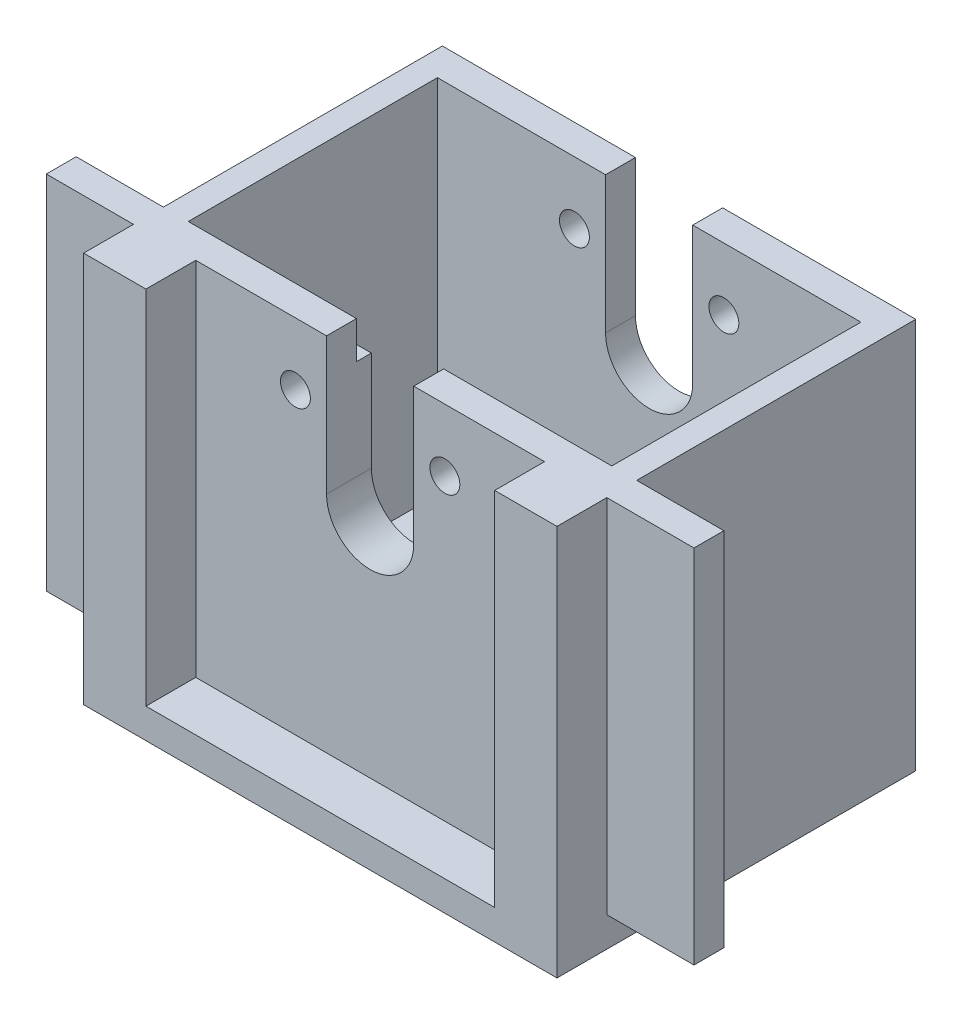
from build123d import *

# Parameters (mm, degrees)
SKETCH_1_W          = 190
SKETCH_1_H          = 144
SKETCH_1_R          = 6
EXTRUDE_1_DEPTH     = 12
SKETCH_2_W          = 190
SKETCH_2_H          = 12
SKETCH_2_W_2        = 260
EXTRUDE_2_DEPTH     = 145
SKETCH_3_R          = 6
CUT_EXTRUDE_1_DEPTH = 239.589605809
SKETCH_4_R          = 6
EXTRUDE_3_DEPTH     = 6
SKETCH_5_W          = 10
SKETCH_5_H          = 100
EXTRUDE_4_DEPTH     = 145
SKETCH_6_W          = 25
SKETCH_6_H          = 20
EXTRUDE_5_DEPTH     = 145


with BuildPart() as part:
    # 草图1 → 凸台-拉伸1 (new body)
    with BuildSketch(Plane(origin=(0, 0, 0), x_dir=(1, 0, 0), z_dir=(0, 1, 0))):
        Rectangle(SKETCH_1_W, SKETCH_1_H)
        with Locations(Location((-57, 41, 0), (0, 0, 270))):
            Circle(SKETCH_1_R, mode=Mode.SUBTRACT)
        with Locations(Location((57, 41, 0), (0, 0, 270))):
            Circle(SKETCH_1_R, mode=Mode.SUBTRACT)
        with Locations(Location((-57, -2, 0), (0, 0, 270))):
            Circle(SKETCH_1_R, mode=Mode.SUBTRACT)
        with Locations(Location((57, -2, 0), (0, 0, 270))):
            Circle(SKETCH_1_R, mode=Mode.SUBTRACT)
    extrude(amount=EXTRUDE_1_DEPTH)

    # 草图2 → 凸台-拉伸2 (add)
    with BuildSketch(Plane(origin=(0, 12, 0), x_dir=(1, 0, 0), z_dir=(0, 1, 0))):
        with Locations((0, 66)):
            Rectangle(SKETCH_2_W, SKETCH_2_H)
        with Locations((0, -46)):
            Rectangle(SKETCH_2_W_2, SKETCH_2_H)
    extrude(amount=EXTRUDE_2_DEPTH)

    # 草图3 → 切除-拉伸1 (cut, through all)
    with BuildSketch(Plane.XY.offset(52)):
        with Locations((-30, 132)):
            Circle(SKETCH_3_R)
        with Locations((30, 132)):
            Circle(SKETCH_3_R)
        with BuildLine():
            Line((-17.5, 157), (17.5, 157))
            Line((17.5, 157), (17.5, 102))
            ThreePointArc((17.5, 102), (0, 84.5), (-17.5, 102))
            Line((-17.5, 102), (-17.5, 157))
        make_face()
    extrude(amount=-CUT_EXTRUDE_1_DEPTH, mode=Mode.SUBTRACT)

    # 草图4 → 凸台-拉伸3 (add)
    with BuildSketch(Plane(origin=(0, 0, 40), x_dir=(-1, 0, 0), z_dir=(0, 0, -1))):
        with BuildLine():
            Line((-17.5, 142), (-39.5, 142))
            Line((-39.5, 142), (-39.5, 102))
            ThreePointArc((-39.5, 102), (0, 62.5), (39.5, 102))
            Line((39.5, 102), (39.5, 142))
            Line((39.5, 142), (17.5, 142))
            Line((17.5, 142), (17.5, 102))
            ThreePointArc((17.5, 102), (0, 84.5), (-17.5, 102))
            Line((-17.5, 102), (-17.5, 142))
        make_face()
        with Locations(Location((-30, 132, 0), (0, 0, 180))):
            Circle(SKETCH_4_R, mode=Mode.SUBTRACT)
        with Locations(Location((30, 132, 0), (0, 0, 180))):
            Circle(SKETCH_4_R, mode=Mode.SUBTRACT)
    extrude(amount=EXTRUDE_3_DEPTH)

    # 草图5 → 凸台-拉伸4 (add)
    with BuildSketch(Plane(origin=(0, 157, 0), x_dir=(1, 0, 0), z_dir=(0, 1, 0))):
        with Locations((-90, 10)):
            Rectangle(SKETCH_5_W, SKETCH_5_H)
        with Locations((90, 10)):
            Rectangle(SKETCH_5_W, SKETCH_5_H)
    extrude(amount=-EXTRUDE_4_DEPTH)

    # 草图6 → 凸台-拉伸5 (add)
    with BuildSketch(Plane(origin=(0, 12, 0), x_dir=(1, 0, 0), z_dir=(0, 1, 0))):
        with Locations((-82.5, -62)):
            Rectangle(SKETCH_6_W, SKETCH_6_H)
        with Locations((82.5, -62)):
            Rectangle(SKETCH_6_W, SKETCH_6_H)
    extrude(amount=EXTRUDE_5_DEPTH)


solid = part.part
